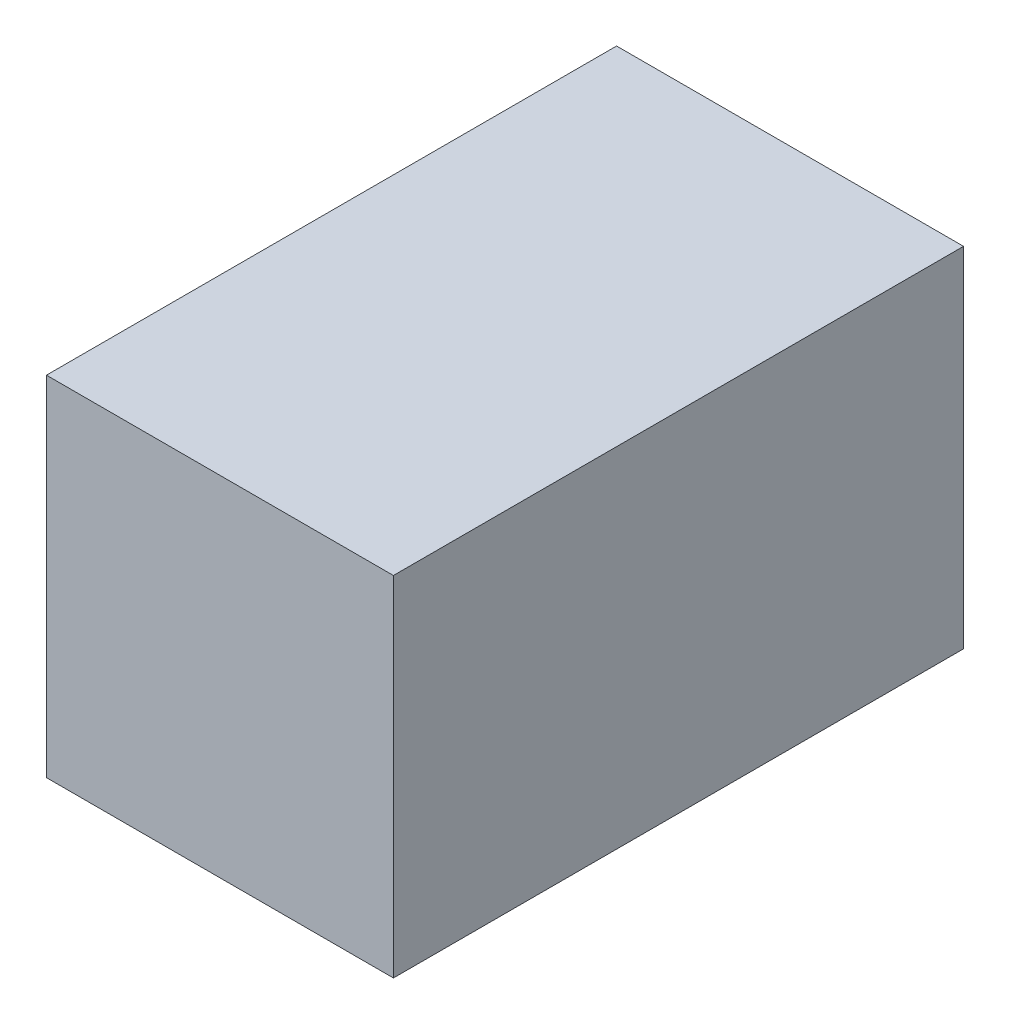
from build123d import *

# Parameters (mm, degrees)
SKETCH1_W           = 213
SKETCH1_H           = 214
BOSS_EXTRUDE1_DEPTH = 350


with BuildPart() as part:
    # Sketch1 → Boss-Extrude1 (new body)
    with BuildSketch(Plane.XY):
        Rectangle(SKETCH1_W, SKETCH1_H)
    extrude(amount=BOSS_EXTRUDE1_DEPTH)


solid = part.part
